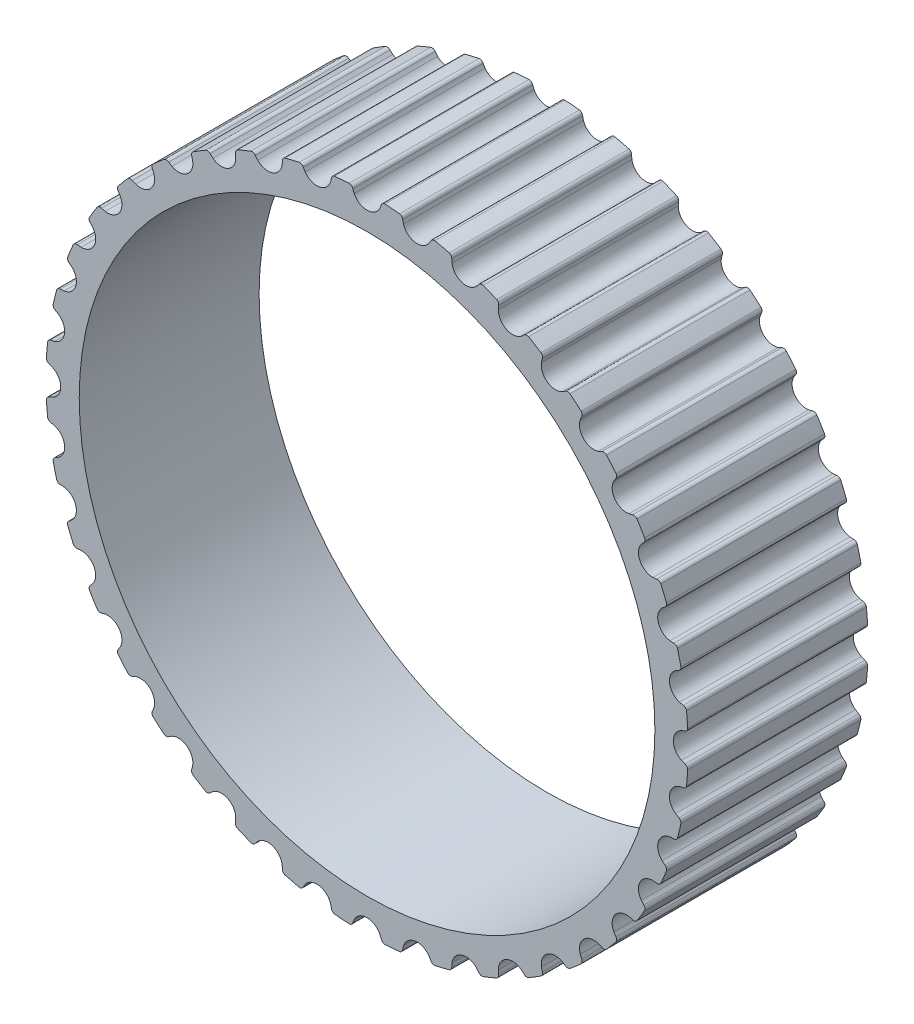
from build123d import *

# Parameters (mm, degrees)
SCHIZZO1_R                   = 11.2
ESTRUSIONE_ESTRUSIONE1_DEPTH = 3.5


with BuildPart() as part:
    # Schizzo1 → Estrusione-Estrusione1 (new, symmetric)
    with BuildSketch(Plane.XY):
        with BuildLine():
            ThreePointArc((0.498876404, 12.231797753), (0, 11.92), (-0.498876404, 12.231797753))
            ThreePointArc((-0.498876404, 12.231797753), (-0.528981368, 12.299873512), (-0.553939201, 12.37))
            ThreePointArc((-0.553939201, 12.37), (-0.608288885, 12.445933866), (-0.697030082, 12.475))
            ThreePointArc((-0.697030082, 12.475), (-0.980303861, 12.455941565), (-1.263071467, 12.430451577))
            ThreePointArc((-1.263071467, 12.430451577), (-1.346173167, 12.387861114), (-1.387975042, 12.304359956))
            ThreePointArc((-1.387975042, 12.304359956), (-1.401655403, 12.231192576), (-1.42074033, 12.159245488))
            ThreePointArc((-1.42074033, 12.159245488), (-1.864698823, 11.77324502), (-2.406209146, 12.003162562))
            ThreePointArc((-2.406209146, 12.003162562), (-2.446592863, 12.065690741), (-2.482213623, 12.131049591))
            ThreePointArc((-2.482213623, 12.131049591), (-2.547772846, 12.197546421), (-2.639968436, 12.212372521))
            ThreePointArc((-2.639968436, 12.212372521), (-2.916773249, 12.149234945), (-3.192072004, 12.079824182))
            ThreePointArc((-3.192072004, 12.079824182), (-3.267487968, 12.024758108), (-3.295712733, 11.935745734))
            ThreePointArc((-3.295712733, 11.935745734), (-3.297778766, 11.861339085), (-3.305373722, 11.787292246))
            ThreePointArc((-3.305373722, 11.787292246), (-3.683482573, 11.336593674), (-4.254293033, 11.478969672))
            ThreePointArc((-4.254293033, 11.478969672), (-4.303961121, 11.53441062), (-4.349367708, 11.593392479))
            ThreePointArc((-4.349367708, 11.593392479), (-4.424522183, 11.648814902), (-4.517902006, 11.6490359))
            ThreePointArc((-4.517902006, 11.6490359), (-4.781422, 11.543373839), (-5.042473134, 11.431751424))
            ThreePointArc((-5.042473134, 11.431751424), (-5.108346371, 11.365565649), (-5.122299039, 11.273233839))
            ThreePointArc((-5.122299039, 11.273233839), (-5.112699872, 11.199420061), (-5.108617843, 11.125096748))
            ThreePointArc((-5.108617843, 11.125096748), (-5.411566757, 10.620797768), (-5.997622106, 10.672126452))
            ThreePointArc((-5.997622106, 10.672126452), (-6.055351573, 10.71911503), (-6.109425924, 10.770267569))
            ThreePointArc((-6.109425924, 10.770267569), (-6.192325101, 10.8132509), (-6.284589835, 10.798861354))
            ThreePointArc((-6.284589835, 10.798861354), (-6.528336272, 10.65327656), (-6.768711841, 10.502191007))
            ThreePointArc((-6.768711841, 10.502191007), (-6.823420332, 10.426515244), (-6.822757343, 10.333137514))
            ThreePointArc((-6.822757343, 10.333137514), (-6.801729339, 10.261734147), (-6.786070839, 10.188964447))
            ThreePointArc((-6.786070839, 10.188964447), (-7.006400207, 9.643482573), (-7.593269817, 9.602500061))
            ThreePointArc((-7.593269817, 9.602500061), (-7.657639172, 9.639879253), (-7.719049799, 9.681942927))
            ThreePointArc((-7.719049799, 9.681942927), (-7.807652423, 9.711428773), (-7.896530204, 9.682783002))
            ThreePointArc((-7.896530204, 9.682783002), (-8.114501239, 9.500860255), (-8.328282398, 9.314031793))
            ThreePointArc((-8.328282398, 9.314031793), (-8.37047904, 9.23072943), (-8.355216718, 9.138605049))
            ThreePointArc((-8.355216718, 9.138605049), (-8.323277655, 9.071370281), (-8.296428249, 9.001946026))
            ThreePointArc((-8.296428249, 9.001946026), (-8.428712832, 8.428712832), (-9.001946026, 8.296428249))
            ThreePointArc((-9.001946026, 8.296428249), (-9.071370281, 8.323277655), (-9.138605049, 8.355216718))
            ThreePointArc((-9.138605049, 8.355216718), (-9.23072943, 8.37047904), (-9.314031793, 8.328282398))
            ThreePointArc((-9.314031793, 8.328282398), (-9.500860255, 8.114501239), (-9.682783002, 7.896530204))
            ThreePointArc((-9.682783002, 7.896530204), (-9.711428773, 7.807652423), (-9.681942927, 7.719049799))
            ThreePointArc((-9.681942927, 7.719049799), (-9.639879253, 7.657639172), (-9.602500061, 7.593269817))
            ThreePointArc((-9.602500061, 7.593269817), (-9.643482573, 7.006400207), (-10.188964447, 6.786070839))
            ThreePointArc((-10.188964447, 6.786070839), (-10.261734147, 6.801729339), (-10.333137514, 6.822757343))
            ThreePointArc((-10.333137514, 6.822757343), (-10.426515244, 6.823420332), (-10.502191007, 6.768711841))
            ThreePointArc((-10.502191007, 6.768711841), (-10.65327656, 6.528336272), (-10.798861354, 6.284589835))
            ThreePointArc((-10.798861354, 6.284589835), (-10.8132509, 6.192325101), (-10.770267569, 6.109425924))
            ThreePointArc((-10.770267569, 6.109425924), (-10.71911503, 6.055351573), (-10.672126452, 5.997622106))
            ThreePointArc((-10.672126452, 5.997622106), (-10.620797768, 5.411566757), (-11.125096748, 5.108617843))
            ThreePointArc((-11.125096748, 5.108617843), (-11.199420061, 5.112699872), (-11.273233839, 5.122299039))
            ThreePointArc((-11.273233839, 5.122299039), (-11.365565649, 5.108346371), (-11.431751424, 5.042473134))
            ThreePointArc((-11.431751424, 5.042473134), (-11.543373839, 4.781422), (-11.6490359, 4.517902006))
            ThreePointArc((-11.6490359, 4.517902006), (-11.648814902, 4.424522183), (-11.593392479, 4.349367708))
            ThreePointArc((-11.593392479, 4.349367708), (-11.53441062, 4.303961121), (-11.478969672, 4.254293033))
            ThreePointArc((-11.478969672, 4.254293033), (-11.336593674, 3.683482573), (-11.787292246, 3.305373722))
            ThreePointArc((-11.787292246, 3.305373722), (-11.861339085, 3.297778766), (-11.935745734, 3.295712733))
            ThreePointArc((-11.935745734, 3.295712733), (-12.024758108, 3.267487968), (-12.079824182, 3.192072004))
            ThreePointArc((-12.079824182, 3.192072004), (-12.149234945, 2.916773249), (-12.212372521, 2.639968436))
            ThreePointArc((-12.212372521, 2.639968436), (-12.197546421, 2.547772846), (-12.131049591, 2.482213623))
            ThreePointArc((-12.131049591, 2.482213623), (-12.065690741, 2.446592863), (-12.003162562, 2.406209146))
            ThreePointArc((-12.003162562, 2.406209146), (-11.77324502, 1.864698823), (-12.159245488, 1.42074033))
            ThreePointArc((-12.159245488, 1.42074033), (-12.231192576, 1.401655403), (-12.304359956, 1.387975042))
            ThreePointArc((-12.304359956, 1.387975042), (-12.387861114, 1.346173167), (-12.430451577, 1.263071467))
            ThreePointArc((-12.430451577, 1.263071467), (-12.455941565, 0.980303861), (-12.475, 0.697030082))
            ThreePointArc((-12.475, 0.697030082), (-12.445933866, 0.608288885), (-12.37, 0.553939201))
            ThreePointArc((-12.37, 0.553939201), (-12.299873512, 0.528981368), (-12.231797753, 0.498876404))
            ThreePointArc((-12.231797753, 0.498876404), (-11.92, 0), (-12.231797753, -0.498876404))
            ThreePointArc((-12.231797753, -0.498876404), (-12.299873512, -0.528981368), (-12.37, -0.553939201))
            ThreePointArc((-12.37, -0.553939201), (-12.445933866, -0.608288885), (-12.475, -0.697030082))
            ThreePointArc((-12.475, -0.697030082), (-12.455941565, -0.980303861), (-12.430451577, -1.263071467))
            ThreePointArc((-12.430451577, -1.263071467), (-12.387861114, -1.346173167), (-12.304359956, -1.387975042))
            ThreePointArc((-12.304359956, -1.387975042), (-12.231192576, -1.401655403), (-12.159245488, -1.42074033))
            ThreePointArc((-12.159245488, -1.42074033), (-11.77324502, -1.864698823), (-12.003162562, -2.406209146))
            ThreePointArc((-12.003162562, -2.406209146), (-12.065690741, -2.446592863), (-12.131049591, -2.482213623))
            ThreePointArc((-12.131049591, -2.482213623), (-12.197546421, -2.547772846), (-12.212372521, -2.639968436))
            ThreePointArc((-12.212372521, -2.639968436), (-12.149234945, -2.916773249), (-12.079824182, -3.192072004))
            ThreePointArc((-12.079824182, -3.192072004), (-12.024758108, -3.267487968), (-11.935745734, -3.295712733))
            ThreePointArc((-11.935745734, -3.295712733), (-11.861339085, -3.297778766), (-11.787292246, -3.305373722))
            ThreePointArc((-11.787292246, -3.305373722), (-11.336593674, -3.683482573), (-11.478969672, -4.254293033))
            ThreePointArc((-11.478969672, -4.254293033), (-11.53441062, -4.303961121), (-11.593392479, -4.349367708))
            ThreePointArc((-11.593392479, -4.349367708), (-11.648814902, -4.424522183), (-11.6490359, -4.517902006))
            ThreePointArc((-11.6490359, -4.517902006), (-11.543373839, -4.781422), (-11.431751424, -5.042473134))
            ThreePointArc((-11.431751424, -5.042473134), (-11.365565649, -5.108346371), (-11.273233839, -5.122299039))
            ThreePointArc((-11.273233839, -5.122299039), (-11.199420061, -5.112699872), (-11.125096748, -5.108617843))
            ThreePointArc((-11.125096748, -5.108617843), (-10.620797768, -5.411566757), (-10.672126452, -5.997622106))
            ThreePointArc((-10.672126452, -5.997622106), (-10.71911503, -6.055351573), (-10.770267569, -6.109425924))
            ThreePointArc((-10.770267569, -6.109425924), (-10.8132509, -6.192325101), (-10.798861354, -6.284589835))
            ThreePointArc((-10.798861354, -6.284589835), (-10.65327656, -6.528336272), (-10.502191007, -6.768711841))
            ThreePointArc((-10.502191007, -6.768711841), (-10.426515244, -6.823420332), (-10.333137514, -6.822757343))
            ThreePointArc((-10.333137514, -6.822757343), (-10.261734147, -6.801729339), (-10.188964447, -6.786070839))
            ThreePointArc((-10.188964447, -6.786070839), (-9.643482573, -7.006400207), (-9.602500061, -7.593269817))
            ThreePointArc((-9.602500061, -7.593269817), (-9.639879253, -7.657639172), (-9.681942927, -7.719049799))
            ThreePointArc((-9.681942927, -7.719049799), (-9.711428773, -7.807652423), (-9.682783002, -7.896530204))
            ThreePointArc((-9.682783002, -7.896530204), (-9.500860255, -8.114501239), (-9.314031793, -8.328282398))
            ThreePointArc((-9.314031793, -8.328282398), (-9.23072943, -8.37047904), (-9.138605049, -8.355216718))
            ThreePointArc((-9.138605049, -8.355216718), (-9.071370281, -8.323277655), (-9.001946026, -8.296428249))
            ThreePointArc((-9.001946026, -8.296428249), (-8.428712832, -8.428712832), (-8.296428249, -9.001946026))
            ThreePointArc((-8.296428249, -9.001946026), (-8.323277655, -9.071370281), (-8.355216718, -9.138605049))
            ThreePointArc((-8.355216718, -9.138605049), (-8.37047904, -9.23072943), (-8.328282398, -9.314031793))
            ThreePointArc((-8.328282398, -9.314031793), (-8.114501239, -9.500860255), (-7.896530204, -9.682783002))
            ThreePointArc((-7.896530204, -9.682783002), (-7.807652423, -9.711428773), (-7.719049799, -9.681942927))
            ThreePointArc((-7.719049799, -9.681942927), (-7.657639172, -9.639879253), (-7.593269817, -9.602500061))
            ThreePointArc((-7.593269817, -9.602500061), (-7.006400207, -9.643482573), (-6.786070839, -10.188964447))
            ThreePointArc((-6.786070839, -10.188964447), (-6.801729339, -10.261734147), (-6.822757343, -10.333137514))
            ThreePointArc((-6.822757343, -10.333137514), (-6.823420332, -10.426515244), (-6.768711841, -10.502191007))
            ThreePointArc((-6.768711841, -10.502191007), (-6.528336272, -10.65327656), (-6.284589835, -10.798861354))
            ThreePointArc((-6.284589835, -10.798861354), (-6.192325101, -10.8132509), (-6.109425924, -10.770267569))
            ThreePointArc((-6.109425924, -10.770267569), (-6.055351573, -10.71911503), (-5.997622106, -10.672126452))
            ThreePointArc((-5.997622106, -10.672126452), (-5.411566757, -10.620797768), (-5.108617843, -11.125096748))
            ThreePointArc((-5.108617843, -11.125096748), (-5.112699872, -11.199420061), (-5.122299039, -11.273233839))
            ThreePointArc((-5.122299039, -11.273233839), (-5.108346371, -11.365565649), (-5.042473134, -11.431751424))
            ThreePointArc((-5.042473134, -11.431751424), (-4.781422, -11.543373839), (-4.517902006, -11.6490359))
            ThreePointArc((-4.517902006, -11.6490359), (-4.424522183, -11.648814902), (-4.349367708, -11.593392479))
            ThreePointArc((-4.349367708, -11.593392479), (-4.303961121, -11.53441062), (-4.254293033, -11.478969672))
            ThreePointArc((-4.254293033, -11.478969672), (-3.683482573, -11.336593674), (-3.305373722, -11.787292246))
            ThreePointArc((-3.305373722, -11.787292246), (-3.297778766, -11.861339085), (-3.295712733, -11.935745734))
            ThreePointArc((-3.295712733, -11.935745734), (-3.267487968, -12.024758108), (-3.192072004, -12.079824182))
            ThreePointArc((-3.192072004, -12.079824182), (-2.916773249, -12.149234945), (-2.639968436, -12.212372521))
            ThreePointArc((-2.639968436, -12.212372521), (-2.547772846, -12.197546421), (-2.482213623, -12.131049591))
            ThreePointArc((-2.482213623, -12.131049591), (-2.446592863, -12.065690741), (-2.406209146, -12.003162562))
            ThreePointArc((-2.406209146, -12.003162562), (-1.864698823, -11.77324502), (-1.42074033, -12.159245488))
            ThreePointArc((-1.42074033, -12.159245488), (-1.401655403, -12.231192576), (-1.387975042, -12.304359956))
            ThreePointArc((-1.387975042, -12.304359956), (-1.346173167, -12.387861114), (-1.263071467, -12.430451577))
            ThreePointArc((-1.263071467, -12.430451577), (-0.980303861, -12.455941565), (-0.697030082, -12.475))
            ThreePointArc((-0.697030082, -12.475), (-0.608288885, -12.445933866), (-0.553939201, -12.37))
            ThreePointArc((-0.553939201, -12.37), (-0.528981368, -12.299873512), (-0.498876404, -12.231797753))
            ThreePointArc((-0.498876404, -12.231797753), (0, -11.92), (0.498876404, -12.231797753))
            ThreePointArc((0.498876404, -12.231797753), (0.528981368, -12.299873512), (0.553939201, -12.37))
            ThreePointArc((0.553939201, -12.37), (0.608288885, -12.445933866), (0.697030082, -12.475))
            ThreePointArc((0.697030082, -12.475), (0.980303861, -12.455941565), (1.263071467, -12.430451577))
            ThreePointArc((1.263071467, -12.430451577), (1.346173167, -12.387861114), (1.387975042, -12.304359956))
            ThreePointArc((1.387975042, -12.304359956), (1.401655403, -12.231192576), (1.42074033, -12.159245488))
            ThreePointArc((1.42074033, -12.159245488), (1.864698823, -11.77324502), (2.406209146, -12.003162562))
            ThreePointArc((2.406209146, -12.003162562), (2.446592863, -12.065690741), (2.482213623, -12.131049591))
            ThreePointArc((2.482213623, -12.131049591), (2.547772846, -12.197546421), (2.639968436, -12.212372521))
            ThreePointArc((2.639968436, -12.212372521), (2.916773249, -12.149234945), (3.192072004, -12.079824182))
            ThreePointArc((3.192072004, -12.079824182), (3.267487968, -12.024758108), (3.295712733, -11.935745734))
            ThreePointArc((3.295712733, -11.935745734), (3.297778766, -11.861339085), (3.305373722, -11.787292246))
            ThreePointArc((3.305373722, -11.787292246), (3.683482573, -11.336593674), (4.254293033, -11.478969672))
            ThreePointArc((4.254293033, -11.478969672), (4.303961121, -11.53441062), (4.349367708, -11.593392479))
            ThreePointArc((4.349367708, -11.593392479), (4.424522183, -11.648814902), (4.517902006, -11.6490359))
            ThreePointArc((4.517902006, -11.6490359), (4.781422, -11.543373839), (5.042473134, -11.431751424))
            ThreePointArc((5.042473134, -11.431751424), (5.108346371, -11.365565649), (5.122299039, -11.273233839))
            ThreePointArc((5.122299039, -11.273233839), (5.112699872, -11.199420061), (5.108617843, -11.125096748))
            ThreePointArc((5.108617843, -11.125096748), (5.411566757, -10.620797768), (5.997622106, -10.672126452))
            ThreePointArc((5.997622106, -10.672126452), (6.055351573, -10.71911503), (6.109425924, -10.770267569))
            ThreePointArc((6.109425924, -10.770267569), (6.192325101, -10.8132509), (6.284589835, -10.798861354))
            ThreePointArc((6.284589835, -10.798861354), (6.528336272, -10.65327656), (6.768711841, -10.502191007))
            ThreePointArc((6.768711841, -10.502191007), (6.823420332, -10.426515244), (6.822757343, -10.333137514))
            ThreePointArc((6.822757343, -10.333137514), (6.801729339, -10.261734147), (6.786070839, -10.188964447))
            ThreePointArc((6.786070839, -10.188964447), (7.006400207, -9.643482573), (7.593269817, -9.602500061))
            ThreePointArc((7.593269817, -9.602500061), (7.657639172, -9.639879253), (7.719049799, -9.681942927))
            ThreePointArc((7.719049799, -9.681942927), (7.807652423, -9.711428773), (7.896530204, -9.682783002))
            ThreePointArc((7.896530204, -9.682783002), (8.114501239, -9.500860255), (8.328282398, -9.314031793))
            ThreePointArc((8.328282398, -9.314031793), (8.37047904, -9.23072943), (8.355216718, -9.138605049))
            ThreePointArc((8.355216718, -9.138605049), (8.323277655, -9.071370281), (8.296428249, -9.001946026))
            ThreePointArc((8.296428249, -9.001946026), (8.428712832, -8.428712832), (9.001946026, -8.296428249))
            ThreePointArc((9.001946026, -8.296428249), (9.071370281, -8.323277655), (9.138605049, -8.355216718))
            ThreePointArc((9.138605049, -8.355216718), (9.23072943, -8.37047904), (9.314031793, -8.328282398))
            ThreePointArc((9.314031793, -8.328282398), (9.500860255, -8.114501239), (9.682783002, -7.896530204))
            ThreePointArc((9.682783002, -7.896530204), (9.711428773, -7.807652423), (9.681942927, -7.719049799))
            ThreePointArc((9.681942927, -7.719049799), (9.639879253, -7.657639172), (9.602500061, -7.593269817))
            ThreePointArc((9.602500061, -7.593269817), (9.643482573, -7.006400207), (10.188964447, -6.786070839))
            ThreePointArc((10.188964447, -6.786070839), (10.261734147, -6.801729339), (10.333137514, -6.822757343))
            ThreePointArc((10.333137514, -6.822757343), (10.426515244, -6.823420332), (10.502191007, -6.768711841))
            ThreePointArc((10.502191007, -6.768711841), (10.65327656, -6.528336272), (10.798861354, -6.284589835))
            ThreePointArc((10.798861354, -6.284589835), (10.8132509, -6.192325101), (10.770267569, -6.109425924))
            ThreePointArc((10.770267569, -6.109425924), (10.71911503, -6.055351573), (10.672126452, -5.997622106))
            ThreePointArc((10.672126452, -5.997622106), (10.620797768, -5.411566757), (11.125096748, -5.108617843))
            ThreePointArc((11.125096748, -5.108617843), (11.199420061, -5.112699872), (11.273233839, -5.122299039))
            ThreePointArc((11.273233839, -5.122299039), (11.365565649, -5.108346371), (11.431751424, -5.042473134))
            ThreePointArc((11.431751424, -5.042473134), (11.543373839, -4.781422), (11.6490359, -4.517902006))
            ThreePointArc((11.6490359, -4.517902006), (11.648814902, -4.424522183), (11.593392479, -4.349367708))
            ThreePointArc((11.593392479, -4.349367708), (11.53441062, -4.303961121), (11.478969672, -4.254293033))
            ThreePointArc((11.478969672, -4.254293033), (11.336593674, -3.683482573), (11.787292246, -3.305373722))
            ThreePointArc((11.787292246, -3.305373722), (11.861339085, -3.297778766), (11.935745734, -3.295712733))
            ThreePointArc((11.935745734, -3.295712733), (12.024758108, -3.267487968), (12.079824182, -3.192072004))
            ThreePointArc((12.079824182, -3.192072004), (12.149234945, -2.916773249), (12.212372521, -2.639968436))
            ThreePointArc((12.212372521, -2.639968436), (12.197546421, -2.547772846), (12.131049591, -2.482213623))
            ThreePointArc((12.131049591, -2.482213623), (12.065690741, -2.446592863), (12.003162562, -2.406209146))
            ThreePointArc((12.003162562, -2.406209146), (11.77324502, -1.864698823), (12.159245488, -1.42074033))
            ThreePointArc((12.159245488, -1.42074033), (12.231192576, -1.401655403), (12.304359956, -1.387975042))
            ThreePointArc((12.304359956, -1.387975042), (12.387861114, -1.346173167), (12.430451577, -1.263071467))
            ThreePointArc((12.430451577, -1.263071467), (12.455941565, -0.980303861), (12.475, -0.697030082))
            ThreePointArc((12.475, -0.697030082), (12.445933866, -0.608288885), (12.37, -0.553939201))
            ThreePointArc((12.37, -0.553939201), (12.299873512, -0.528981368), (12.231797753, -0.498876404))
            ThreePointArc((12.231797753, -0.498876404), (11.92, 0), (12.231797753, 0.498876404))
            ThreePointArc((12.231797753, 0.498876404), (12.299873512, 0.528981368), (12.37, 0.553939201))
            ThreePointArc((12.37, 0.553939201), (12.445933866, 0.608288885), (12.475, 0.697030082))
            ThreePointArc((12.475, 0.697030082), (12.455941565, 0.980303861), (12.430451577, 1.263071467))
            ThreePointArc((12.430451577, 1.263071467), (12.387861114, 1.346173167), (12.304359956, 1.387975042))
            ThreePointArc((12.304359956, 1.387975042), (12.231192576, 1.401655403), (12.159245488, 1.42074033))
            ThreePointArc((12.159245488, 1.42074033), (11.77324502, 1.864698823), (12.003162562, 2.406209146))
            ThreePointArc((12.003162562, 2.406209146), (12.065690741, 2.446592863), (12.131049591, 2.482213623))
            ThreePointArc((12.131049591, 2.482213623), (12.197546421, 2.547772846), (12.212372521, 2.639968436))
            ThreePointArc((12.212372521, 2.639968436), (12.149234945, 2.916773249), (12.079824182, 3.192072004))
            ThreePointArc((12.079824182, 3.192072004), (12.024758108, 3.267487968), (11.935745734, 3.295712733))
            ThreePointArc((11.935745734, 3.295712733), (11.861339085, 3.297778766), (11.787292246, 3.305373722))
            ThreePointArc((11.787292246, 3.305373722), (11.336593674, 3.683482573), (11.478969672, 4.254293033))
            ThreePointArc((11.478969672, 4.254293033), (11.53441062, 4.303961121), (11.593392479, 4.349367708))
            ThreePointArc((11.593392479, 4.349367708), (11.648814902, 4.424522183), (11.6490359, 4.517902006))
            ThreePointArc((11.6490359, 4.517902006), (11.543373839, 4.781422), (11.431751424, 5.042473134))
            ThreePointArc((11.431751424, 5.042473134), (11.365565649, 5.108346371), (11.273233839, 5.122299039))
            ThreePointArc((11.273233839, 5.122299039), (11.199420061, 5.112699872), (11.125096748, 5.108617843))
            ThreePointArc((11.125096748, 5.108617843), (10.620797768, 5.411566757), (10.672126452, 5.997622106))
            ThreePointArc((10.672126452, 5.997622106), (10.71911503, 6.055351573), (10.770267569, 6.109425924))
            ThreePointArc((10.770267569, 6.109425924), (10.8132509, 6.192325101), (10.798861354, 6.284589835))
            ThreePointArc((10.798861354, 6.284589835), (10.65327656, 6.528336272), (10.502191007, 6.768711841))
            ThreePointArc((10.502191007, 6.768711841), (10.426515244, 6.823420332), (10.333137514, 6.822757343))
            ThreePointArc((10.333137514, 6.822757343), (10.261734147, 6.801729339), (10.188964447, 6.786070839))
            ThreePointArc((10.188964447, 6.786070839), (9.643482573, 7.006400207), (9.602500061, 7.593269817))
            ThreePointArc((9.602500061, 7.593269817), (9.639879253, 7.657639172), (9.681942927, 7.719049799))
            ThreePointArc((9.681942927, 7.719049799), (9.711428773, 7.807652423), (9.682783002, 7.896530204))
            ThreePointArc((9.682783002, 7.896530204), (9.500860255, 8.114501239), (9.314031793, 8.328282398))
            ThreePointArc((9.314031793, 8.328282398), (9.23072943, 8.37047904), (9.138605049, 8.355216718))
            ThreePointArc((9.138605049, 8.355216718), (9.071370281, 8.323277655), (9.001946026, 8.296428249))
            ThreePointArc((9.001946026, 8.296428249), (8.428712832, 8.428712832), (8.296428249, 9.001946026))
            ThreePointArc((8.296428249, 9.001946026), (8.323277655, 9.071370281), (8.355216718, 9.138605049))
            ThreePointArc((8.355216718, 9.138605049), (8.37047904, 9.23072943), (8.328282398, 9.314031793))
            ThreePointArc((8.328282398, 9.314031793), (8.114501239, 9.500860255), (7.896530204, 9.682783002))
            ThreePointArc((7.896530204, 9.682783002), (7.807652423, 9.711428773), (7.719049799, 9.681942927))
            ThreePointArc((7.719049799, 9.681942927), (7.657639172, 9.639879253), (7.593269817, 9.602500061))
            ThreePointArc((7.593269817, 9.602500061), (7.006400207, 9.643482573), (6.786070839, 10.188964447))
            ThreePointArc((6.786070839, 10.188964447), (6.801729339, 10.261734147), (6.822757343, 10.333137514))
            ThreePointArc((6.822757343, 10.333137514), (6.823420332, 10.426515244), (6.768711841, 10.502191007))
            ThreePointArc((6.768711841, 10.502191007), (6.528336272, 10.65327656), (6.284589835, 10.798861354))
            ThreePointArc((6.284589835, 10.798861354), (6.192325101, 10.8132509), (6.109425924, 10.770267569))
            ThreePointArc((6.109425924, 10.770267569), (6.055351573, 10.71911503), (5.997622106, 10.672126452))
            ThreePointArc((5.997622106, 10.672126452), (5.411566757, 10.620797768), (5.108617843, 11.125096748))
            ThreePointArc((5.108617843, 11.125096748), (5.112699872, 11.199420061), (5.122299039, 11.273233839))
            ThreePointArc((5.122299039, 11.273233839), (5.108346371, 11.365565649), (5.042473134, 11.431751424))
            ThreePointArc((5.042473134, 11.431751424), (4.781422, 11.543373839), (4.517902006, 11.6490359))
            ThreePointArc((4.517902006, 11.6490359), (4.424522183, 11.648814902), (4.349367708, 11.593392479))
            ThreePointArc((4.349367708, 11.593392479), (4.303961121, 11.53441062), (4.254293033, 11.478969672))
            ThreePointArc((4.254293033, 11.478969672), (3.683482573, 11.336593674), (3.305373722, 11.787292246))
            ThreePointArc((3.305373722, 11.787292246), (3.297778766, 11.861339085), (3.295712733, 11.935745734))
            ThreePointArc((3.295712733, 11.935745734), (3.267487968, 12.024758108), (3.192072004, 12.079824182))
            ThreePointArc((3.192072004, 12.079824182), (2.916773249, 12.149234945), (2.639968436, 12.212372521))
            ThreePointArc((2.639968436, 12.212372521), (2.547772846, 12.197546421), (2.482213623, 12.131049591))
            ThreePointArc((2.482213623, 12.131049591), (2.446592863, 12.065690741), (2.406209146, 12.003162562))
            ThreePointArc((2.406209146, 12.003162562), (1.864698823, 11.77324502), (1.42074033, 12.159245488))
            ThreePointArc((1.42074033, 12.159245488), (1.401655403, 12.231192576), (1.387975042, 12.304359956))
            ThreePointArc((1.387975042, 12.304359956), (1.346173167, 12.387861114), (1.263071467, 12.430451577))
            ThreePointArc((1.263071467, 12.430451577), (0.980303861, 12.455941565), (0.697030082, 12.475))
            ThreePointArc((0.697030082, 12.475), (0.608288885, 12.445933866), (0.553939201, 12.37))
            ThreePointArc((0.553939201, 12.37), (0.528981368, 12.299873512), (0.498876404, 12.231797753))
        make_face()
        Circle(SCHIZZO1_R, mode=Mode.SUBTRACT)
    extrude(amount=ESTRUSIONE_ESTRUSIONE1_DEPTH, both=True)


solid = part.part
